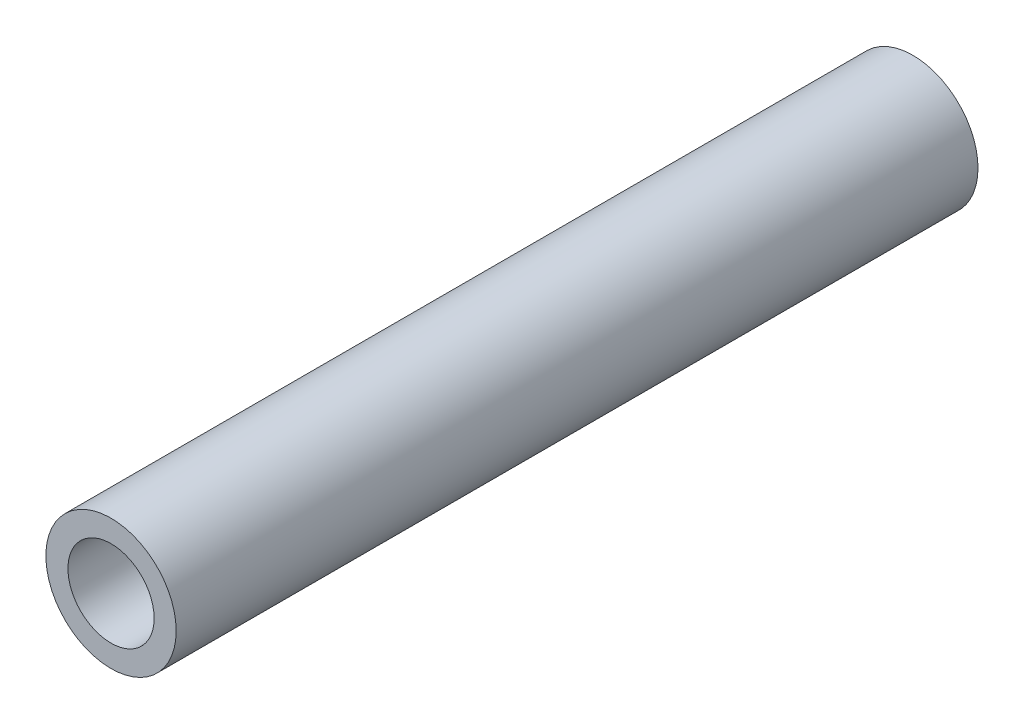
from build123d import *

# Parameters (mm, degrees)
SKETCH2_R           = 6.5
SKETCH2_R_2         = 4.3
BOSS_EXTRUDE1_DEPTH = 80


with BuildPart() as part:
    # Sketch2 → Boss-Extrude1 (new body)
    with BuildSketch(Plane.XY):
        with Locations((67.606601718, -8.506601718)):
            Circle(SKETCH2_R)
        with Locations((67.606601718, -8.506601718)):
            Circle(SKETCH2_R_2, mode=Mode.SUBTRACT)
    extrude(amount=BOSS_EXTRUDE1_DEPTH)


solid = part.part
